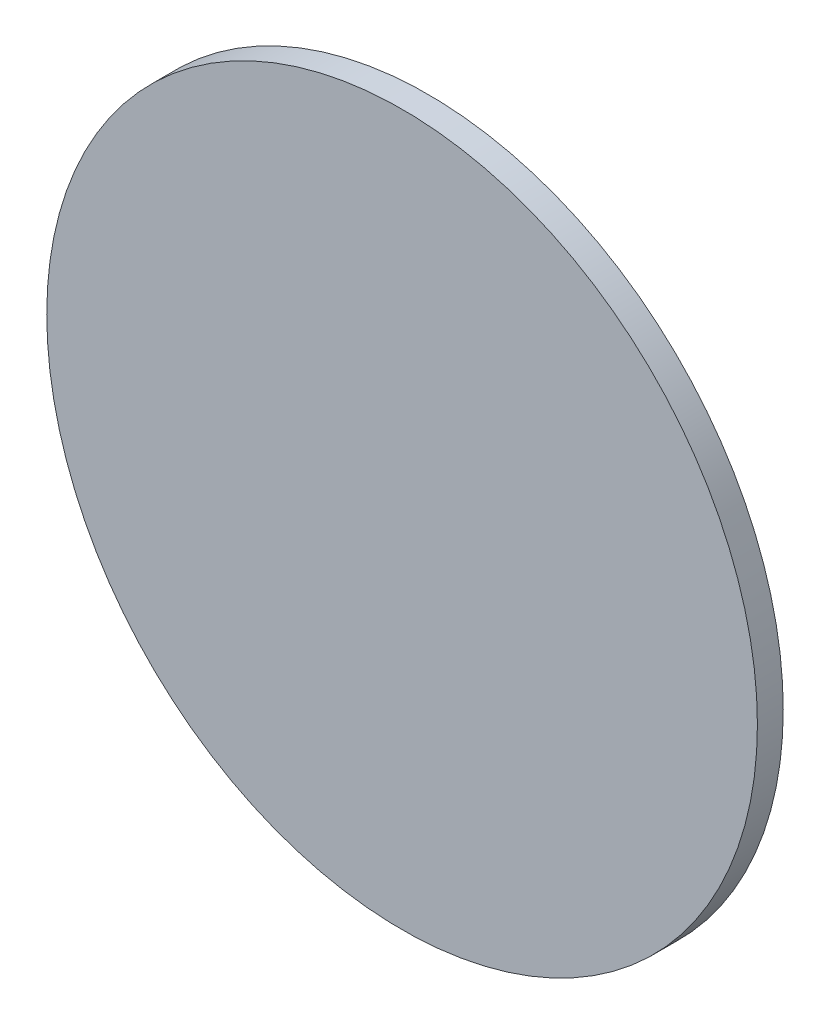
from build123d import *

# Parameters (mm, degrees)
SKETCH1_R           = 82.55
BOSS_EXTRUDE1_DEPTH = 6


with BuildPart() as part:
    # Sketch1 → Boss-Extrude1 (new body)
    with BuildSketch(Plane.XY):
        Circle(SKETCH1_R)
    extrude(amount=BOSS_EXTRUDE1_DEPTH)


solid = part.part
